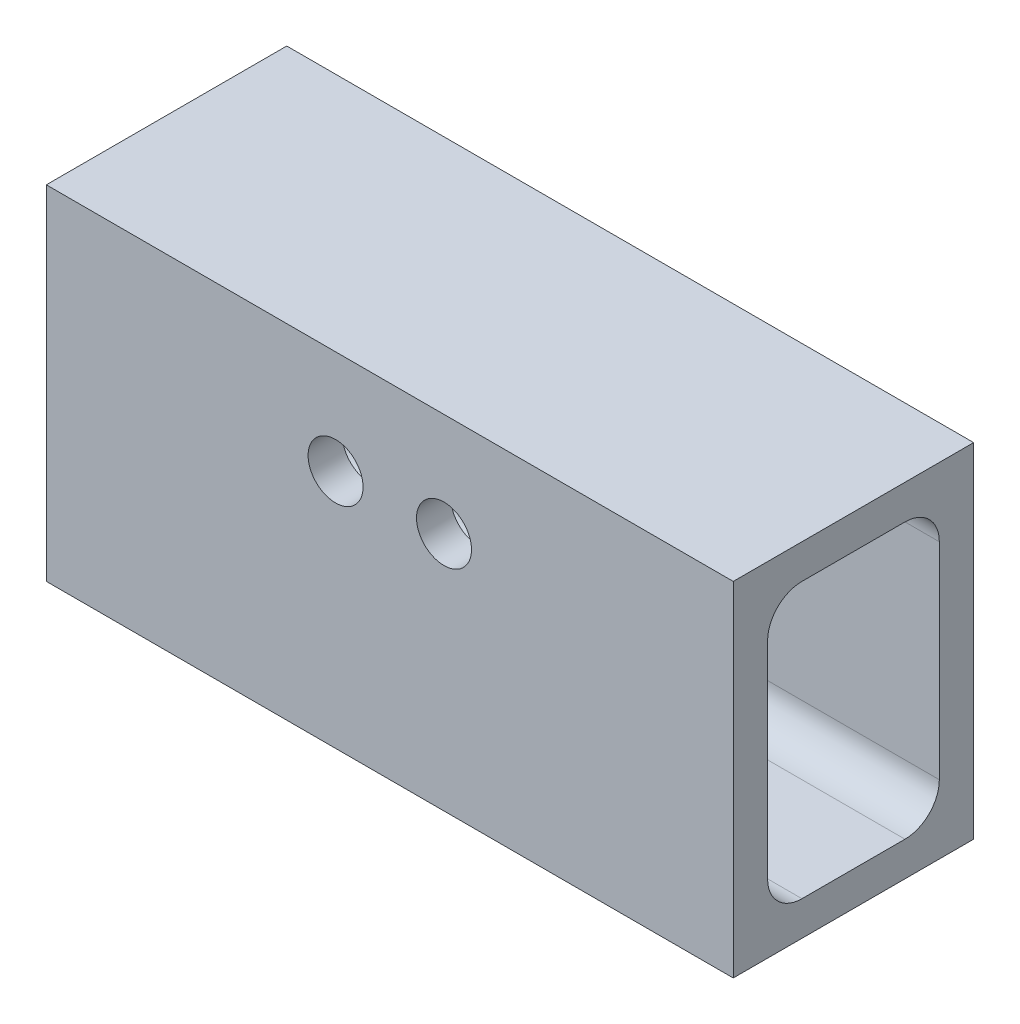
from build123d import *

# Parameters (mm, degrees)
SKETCH3_W           = 100
SKETCH3_H           = 50
BOSS_EXTRUDE1_DEPTH = 35
SKETCH4_W           = 25
SKETCH4_H           = 40
CUT_EXTRUDE2_DEPTH  = 100
SKETCH5_R           = 4.002277078
CUT_EXTRUDE4_DEPTH  = 5
FILLET2_R           = 5
FILLET3_R           = 5
FILLET4_R           = 5
FILLET5_R           = 5
SCALE1_SCALE        = 0.15


with BuildPart() as part:
    # Sketch3 → Boss-Extrude1 (new body)
    with BuildSketch(Plane.XY):
        with Locations((2.343116294, 2.356397797)):
            Rectangle(SKETCH3_W, SKETCH3_H)
    extrude(amount=BOSS_EXTRUDE1_DEPTH)

    # Sketch4 → Cut-Extrude2 (cut)
    with BuildSketch(Plane.ZY.offset(47.656883706)):
        with Locations((17.5, 2.356397797)):
            Rectangle(SKETCH4_W, SKETCH4_H)
    extrude(amount=-CUT_EXTRUDE2_DEPTH, mode=Mode.SUBTRACT)

    # Sketch5 → Cut-Extrude4 (cut)
    with BuildSketch(Plane.XY.offset(35)):
        with Locations((-5.550407573, 12.303618629)):
            Circle(SKETCH5_R)
        with Locations(Location((10.236640162, 12.303618629, 0), (0, 0, 180))):
            Circle(SKETCH5_R)
    extrude(amount=-CUT_EXTRUDE4_DEPTH, mode=Mode.SUBTRACT)

    # Fillet2
    fillet2_edges = [part.edges().sort_by_distance(p)[0] for p in [
        (2.343116294, 22.356397797, 5),
    ]]
    fillet(fillet2_edges, radius=FILLET2_R)

    # Fillet3
    fillet3_edges = [part.edges().sort_by_distance(p)[0] for p in [
        (2.343116294, 22.356397797, 30),
    ]]
    fillet(fillet3_edges, radius=FILLET3_R)

    # Fillet4
    fillet4_edges = [part.edges().sort_by_distance(p)[0] for p in [
        (2.343116294, -17.643602203, 5),
    ]]
    fillet(fillet4_edges, radius=FILLET4_R)

    # Fillet5
    fillet5_edges = [part.edges().sort_by_distance(p)[0] for p in [
        (2.343116294, -17.643602203, 30),
    ]]
    fillet(fillet5_edges, radius=FILLET5_R)


with BuildPart() as part_1:
    # Scale1: scaled about (2.343116294, 2.291085551, 17.401511818)
    add(part.part.scale(SCALE1_SCALE).moved(Location((1.99164885, 1.947422718, 14.791285045))))


solid = part_1.part
